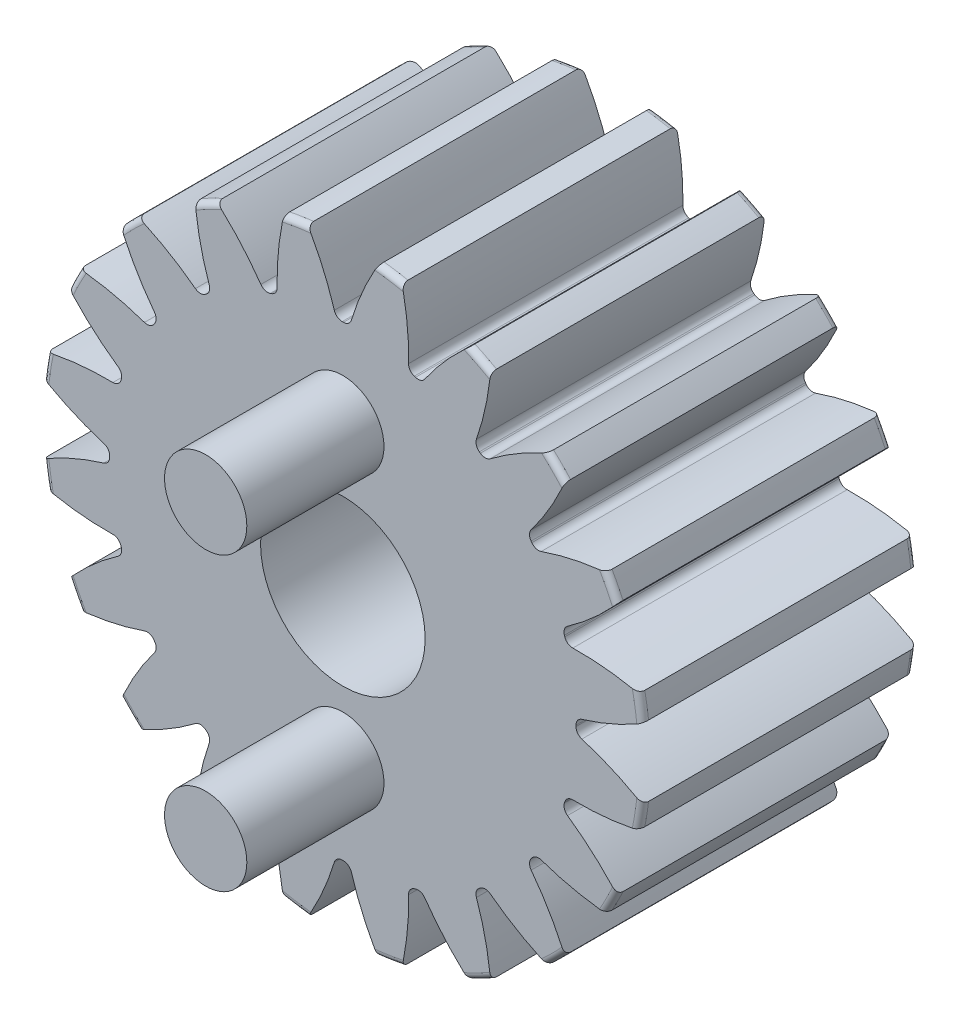
from build123d import *

# Parameters (mm, degrees)
FILLET2_R           = 0.2794
CUT_EXTRUDE2_DEPTH  = 24.486417411
CIRPATTERN1_COUNT   = 20
SKETCH11_R          = 11.43
CUT_EXTRUDE3_DEPTH  = 11.1252
SKETCH13_R          = 6.35
BOSS_EXTRUDE1_DEPTH = 12.7
SKETCH15_R          = 3.81
CUT_EXTRUDE4_DEPTH  = 24.372927403
SKETCH16_R          = 1.905
BOSS_EXTRUDE2_DEPTH = 6.35


with BuildPart() as part:
    # Sketch4 → Revolve1 (revolve)
    with BuildSketch(Plane(origin=(0, 0, 0), x_dir=(0, 0, -1), z_dir=(1, 0, 0))):
        Polygon((-23.8252, 6.35), (-23.8252, 10.8331), (-12.7, 10.8331), (-12.7, 13.97), (0, 13.97), (0, 6.35), align=None)
    revolve(axis=Axis((0, 0, 12.7), (0, 0, 1)))

    # Fillet2
    fillet2_edges = [part.edges().sort_by_distance(p)[0] for p in [
        (0, -13.97, 0),
        (0, -13.97, 12.7),
        (0, -10.8331, 12.7),
        (0, -10.8331, 23.8252),
    ]]
    fillet(fillet2_edges, radius=FILLET2_R)

    # Sketch7 → Cut-Extrude2 (cut, through all)
    with BuildSketch(Plane.XY.offset(12.7)):
        with BuildLine():
            ThreePointArc((-0.029449487, 10.79495983), (0, 10.795), (0.029449487, 10.79495983))
            ThreePointArc((0.029449487, 10.79495983), (0.257238629, 10.869772623), (0.395246272, 11.06583062))
            ThreePointArc((0.395246272, 11.06583062), (0.92781573, 12.507614405), (1.630655191, 13.874504087))
            ThreePointArc((1.630655191, 13.874504087), (0, 13.97), (-1.630655191, 13.874504087))
            ThreePointArc((-1.630655191, 13.874504087), (-0.92781573, 12.507614405), (-0.395246272, 11.06583062))
            ThreePointArc((-0.395246272, 11.06583062), (-0.257238629, 10.869772623), (-0.029449487, 10.79495983))
        make_face()
    cut_extrude2 = extrude(amount=-CUT_EXTRUDE2_DEPTH, mode=Mode.SUBTRACT)

    # CirPattern1: Cut-Extrude2 ×20 about axis
    cirpattern1_axis = Axis((0, 0, 0), (0, 0, 1))
    for i in range(1, CIRPATTERN1_COUNT):
        add(cut_extrude2.rotate(cirpattern1_axis, i * 360 / CIRPATTERN1_COUNT), mode=Mode.SUBTRACT)

    # Sketch11 → Cut-Extrude3 (cut)
    with BuildSketch(Plane.XY.offset(23.8252)):
        Circle(SKETCH11_R)
    extrude(amount=-CUT_EXTRUDE3_DEPTH, mode=Mode.SUBTRACT)

    # Sketch13 → Boss-Extrude1 (add)
    with BuildSketch(Plane.XY.offset(12.7)):
        Circle(SKETCH13_R)
    extrude(amount=-BOSS_EXTRUDE1_DEPTH)

    # Sketch15 → Cut-Extrude4 (cut, through all)
    with BuildSketch(Plane(origin=(0, 0, 0), x_dir=(-1, 0, 0), z_dir=(0, 0, -1))):
        with Locations(Location((0, 0, 0), (0, 0, 90))):
            Circle(SKETCH15_R)
    extrude(amount=-CUT_EXTRUDE4_DEPTH, mode=Mode.SUBTRACT)

    # Sketch16 → Boss-Extrude2 (add)
    with BuildSketch(Plane.XY.offset(12.7)):
        with Locations((0, -6.746875)):
            Circle(SKETCH16_R)
        with Locations((0, 6.746875)):
            Circle(SKETCH16_R)
    extrude(amount=BOSS_EXTRUDE2_DEPTH)


solid = part.part
